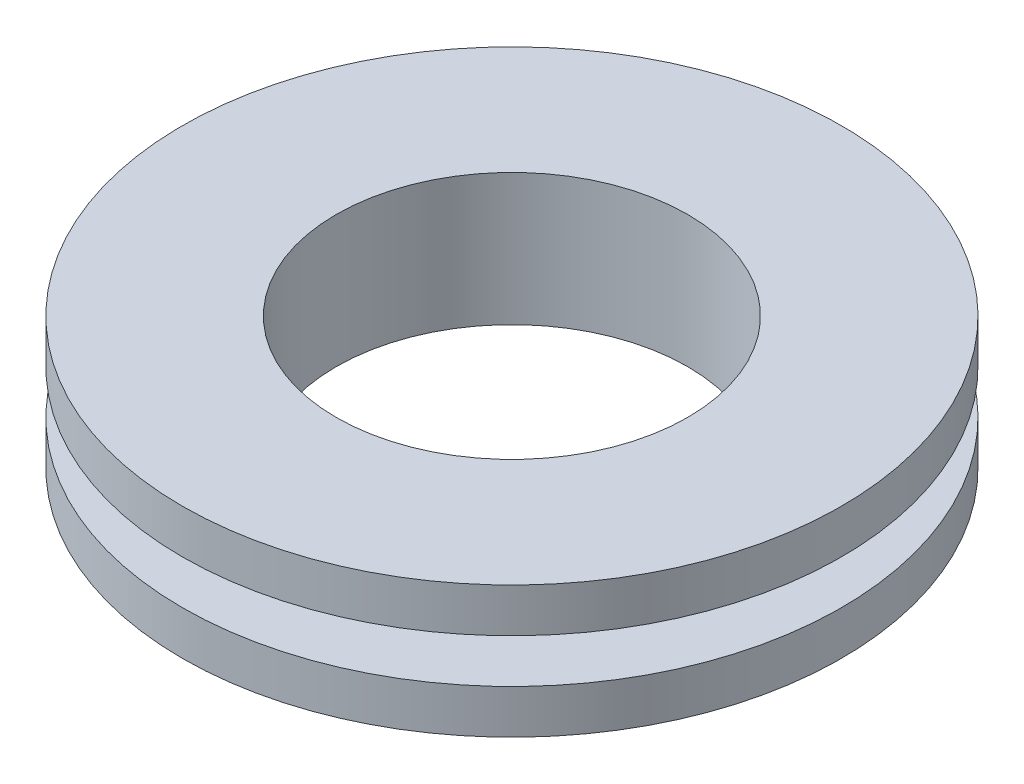
from build123d import *


with BuildPart() as part:
    # Sketch1 → Revolve1 (revolve)
    with BuildSketch(Plane.XY, mode=Mode.PRIVATE) as revolve1_sk:
        Polygon((4, 1.5), (4, -1.5), (7.5, -1.5), (7.5, -0.5), (6, -0.5), (6, 0.5), (7.5, 0.5), (7.5, 1.5), align=None)
    revolve(revolve1_sk.sketch.rotate(Axis((0, 5.870558795, 0), (0, -1, 0)), 90), axis=Axis((0, 5.870558795, 0), (0, -1, 0)))


solid = part.part
